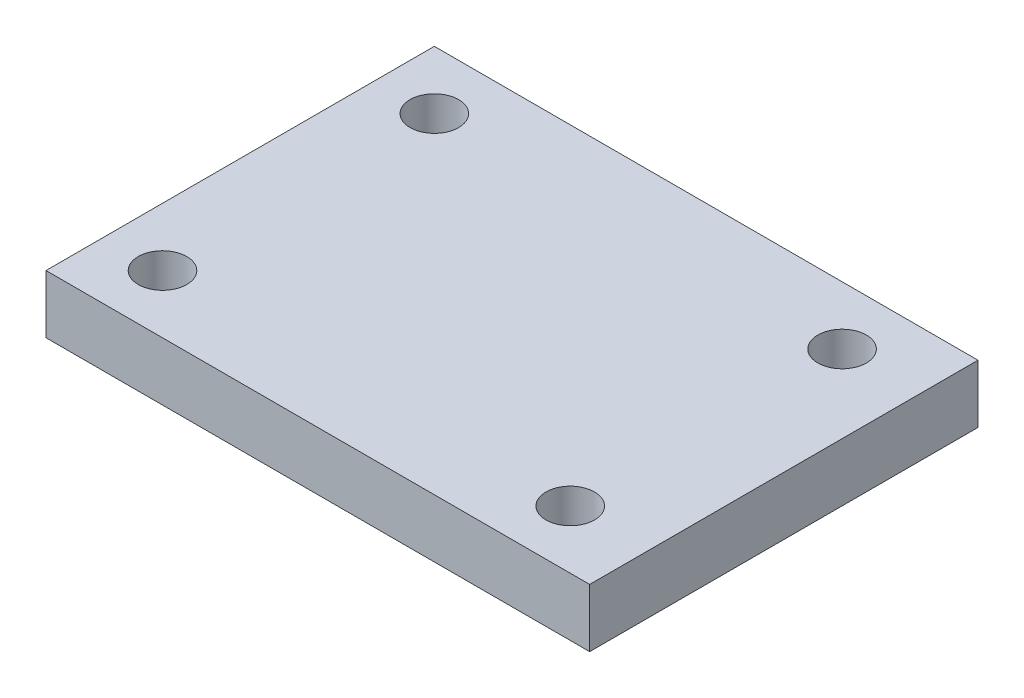
from build123d import *

# Parameters (mm, degrees)
SKETCH1_W           = 28
SKETCH1_H           = 20
BOSS_EXTRUDE1_DEPTH = 3
M3_TAPPED_HOLE1_D   = 2.5


with BuildPart() as part:
    # Sketch1 → Boss-Extrude1 (new body)
    with BuildSketch(Plane(origin=(0, 0, 0), x_dir=(1, 0, 0), z_dir=(0, 1, 0))):
        Rectangle(SKETCH1_W, SKETCH1_H)
    extrude(amount=BOSS_EXTRUDE1_DEPTH)

    # M3 Tapped Hole1 (through all)
    with Locations(Plane(origin=(0, 3, 0), x_dir=(1, 0, 0), z_dir=(0, 1, 0))):
        with Locations((-11, 7), (10, 7), (10, -7), (-11, -7)):
            Hole(M3_TAPPED_HOLE1_D / 2)


solid = part.part
